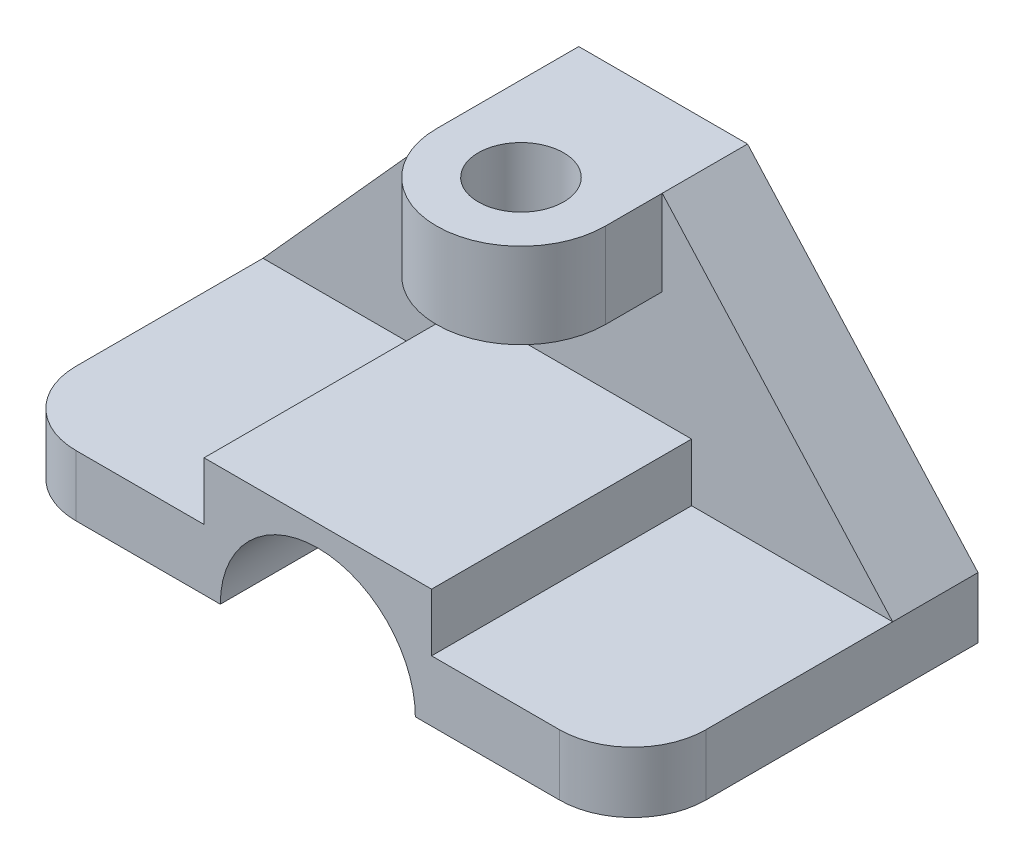
from build123d import *

# Parameters (mm, degrees)
EXTRUDE_1_DEPTH     = 85
EXTRUDE_2_DEPTH     = 21
CUT_EXTRUDE_1_DEPTH = 21
CUT_EXTRUDE_2_DEPTH = 21
SKETCH_4_W          = 41.549090418
SKETCH_4_H          = 35
EXTRUDE_3_DEPTH     = 21
SKETCH_5_R          = 20.774545209
SKETCH_5_R_2        = 10.5
EXTRUDE_4_DEPTH     = 21
SKETCH_7_R          = 10.5
CUT_EXTRUDE_3_DEPTH = 21


with BuildPart() as part:
    # 스케치1 → 보스-돌출1 (new body)
    with BuildSketch(Plane.XY):
        with BuildLine():
            ThreePointArc((-24, 0), (0, 24), (24, 0))
            Line((24, 0), (77.5, 0))
            Line((77.5, 0), (77.5, 15))
            Line((77.5, 15), (28, 15))
            Line((28, 15), (28, 29.218478607))
            Line((28, 29.218478607), (-28, 29.218478607))
            Line((-28, 29.218478607), (-28, 15))
            Line((-28, 15), (-77.5, 15))
            Line((-77.5, 15), (-77.5, 0))
            Line((-77.5, 0), (-24, 0))
        make_face()
    extrude(amount=EXTRUDE_1_DEPTH)

    # 스케치1<3> → 보스-돌출2 (add)
    with BuildSketch(Plane.XY):
        Polygon((-28, 29.218478607), (28, 29.218478607), (28, 15), (77.5, 15), (20.774545209, 78), (20.774545209, 57), (-20.774545209, 57), (-20.774545209, 78), (-77.5, 15), (-28, 15), align=None)
    extrude(amount=EXTRUDE_2_DEPTH)

    # 스케치3 → 컷-돌출1 (cut)
    with BuildSketch(Plane(origin=(0, 15, 0), x_dir=(1, 0, 0), z_dir=(0, 1, 0))):
        with BuildLine():
            ThreePointArc((77.5, -67), (72.227922061, -79.727922061), (59.5, -85))
            Line((59.5, -85), (77.5, -85))
            Line((77.5, -85), (77.5, -67))
        make_face()
    extrude(amount=-CUT_EXTRUDE_1_DEPTH, mode=Mode.SUBTRACT)

    # 스케치2 → 컷-돌출2 (cut)
    with BuildSketch(Plane(origin=(0, 15, 0), x_dir=(1, 0, 0), z_dir=(0, 1, 0))):
        with BuildLine():
            ThreePointArc((-59.5, -85), (-72.227922061, -79.727922061), (-77.5, -67))
            Line((-77.5, -67), (-77.5, -85))
            Line((-77.5, -85), (-59.5, -85))
        make_face()
    extrude(amount=-CUT_EXTRUDE_2_DEPTH, mode=Mode.SUBTRACT)

    # 스케치4 → 보스-돌출3 (add)
    with BuildSketch(Plane(origin=(0, 57, 0), x_dir=(1, 0, 0), z_dir=(0, 1, 0))):
        with Locations((0, -17.5)):
            Rectangle(SKETCH_4_W, SKETCH_4_H)
    extrude(amount=EXTRUDE_3_DEPTH)

    # 스케치5 → 보스-돌출4 (add)
    with BuildSketch(Plane(origin=(0, 78, 0), x_dir=(1, 0, 0), z_dir=(0, 1, 0))):
        with Locations((0, -35)):
            Circle(SKETCH_5_R)
        with Locations((0, -35)):
            Circle(SKETCH_5_R_2, mode=Mode.SUBTRACT)
    extrude(amount=-EXTRUDE_4_DEPTH)

    # 스케치7 → 컷-돌출3 (cut)
    with BuildSketch(Plane(origin=(0, 78, 0), x_dir=(1, 0, 0), z_dir=(0, 1, 0))):
        with Locations((0, -35)):
            Circle(SKETCH_7_R)
    extrude(amount=-CUT_EXTRUDE_3_DEPTH, mode=Mode.SUBTRACT)


solid = part.part
